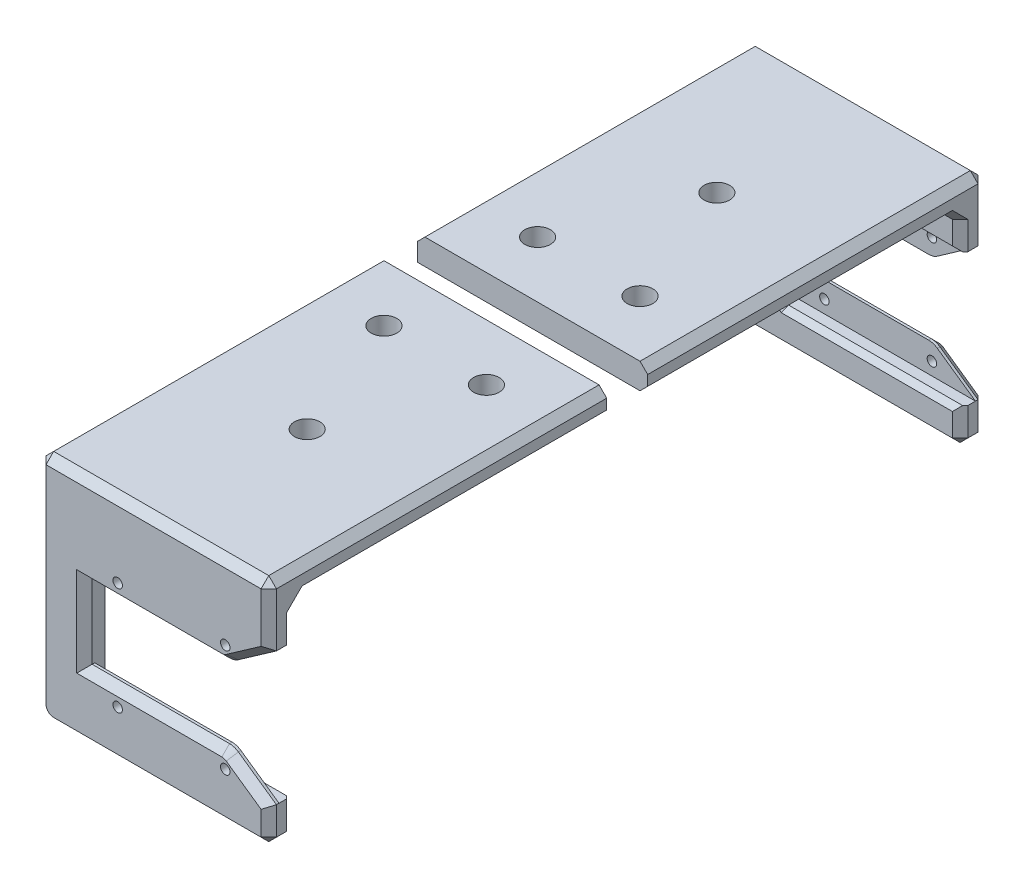
from build123d import *

# Parameters (mm, degrees)
EXTRUDE_1_DEPTH            = 5
SKETCH_2_W                 = 36
SKETCH_2_H                 = 26
CUT_EXTRUDE_1_DEPTH        = 3
CUT_EXTRUDE_2_DEPTH        = 50.497474683
SKETCH_4_R                 = 0.925
CUT_EXTRUDE_3_DEPTH        = 50.335585534
CHAMFER_1_SIZE             = 1.5
CHAMFER_2_SIZE             = 1
FILLET_3_R                 = 3
SKETCH_7_W                 = 45
SKETCH_7_H                 = 140
EXTRUDE_2_DEPTH            = 5
SKETCH_9_R                 = 2.5
CUT_EXTRUDE_5_DEPTH        = 150.248115566
CHAMFER_1_OF_MIRROR_1_SIZE = 1.5
CHAMFER_2_OF_MIRROR_1_SIZE = 1
FILLET_3_OF_MIRROR_1_R     = 3
EXTRUDE_3_DEPTH            = 3
CHAMFER_4_SIZE             = 1.5
SKETCH_12_W                = 45
SKETCH_12_H                = 8
CUT_EXTRUDE_6_DEPTH        = 150.248115566


with BuildPart() as part:
    # 草图1 → 凸台-拉伸1 (new body)
    with BuildSketch(Plane.XY):
        with BuildLine():
            Line((-42, -20), (0, -20))
            ThreePointArc((0, -20), (20, 0), (0, 20))
            Line((0, 20), (-45, 20))
            Line((-45, 20), (-45, -17))
            ThreePointArc((-45, -17), (-44.121320344, -19.121320344), (-42, -20))
        make_face()
    extrude_1 = extrude(amount=EXTRUDE_1_DEPTH)

    # 草图2 → 切除-拉伸1 (cut)
    with BuildSketch(Plane(origin=(0, 0, 0), x_dir=(-1, 0, 0), z_dir=(0, 0, -1))):
        with Locations((18, 0)):
            Rectangle(SKETCH_2_W, SKETCH_2_H)
    cut_extrude_1 = extrude(amount=-CUT_EXTRUDE_1_DEPTH, mode=Mode.SUBTRACT)

    # 草图3 → 切除-拉伸2 (cut, through all)
    with BuildSketch(Plane(origin=(0, 0, 0), x_dir=(-1, 0, 0), z_dir=(0, 0, -1))):
        with BuildLine():
            Line((0, -20), (0, 20))
            ThreePointArc((0, 20), (-20, 0), (0, -20))
        make_face()
    cut_extrude_2 = extrude(amount=-CUT_EXTRUDE_2_DEPTH, mode=Mode.SUBTRACT)

    # 草图4 → 切除-拉伸3 (cut, through all)
    with BuildSketch(Plane(origin=(0, 0, 3), x_dir=(-1, 0, 0), z_dir=(0, 0, -1))):
        with Locations((8.5, 10.5)):
            Circle(SKETCH_4_R)
        with Locations((8.5, -10.5)):
            Circle(SKETCH_4_R)
        with Locations((29.5, 10.5)):
            Circle(SKETCH_4_R)
        with Locations((29.5, -10.5)):
            Circle(SKETCH_4_R)
        Polygon((8.211851039, -7.25), (36, -7.25), (36, 7.25), (8.211851039, 7.25), (0, 13), (0, -13), align=None)
    cut_extrude_3 = extrude(amount=-CUT_EXTRUDE_3_DEPTH, mode=Mode.SUBTRACT)

    # 倒角1
    chamfer_1_edges = [part.edges().sort_by_distance(p)[0] for p in [
        (-36, 13, 1.5),
        (-36, -13, 1.5),
    ]]
    chamfer(chamfer_1_edges, length=CHAMFER_1_SIZE)

    # 倒角2
    chamfer_2_edges = [part.edges().sort_by_distance(p)[0] for p in [
        (-17.25, -13, 0),
        (-17.25, 13, 0),
        (-36, 0, 0),
        (-35.25, 12.25, 0),
        (-35.25, -12.25, 0),
    ]]
    chamfer(chamfer_2_edges, length=CHAMFER_2_SIZE)

    # 圆角3
    fillet_3_edges = [part.edges().sort_by_distance(p)[0] for p in [
        (-8.211851039, 7.25, 4),
        (-8.211851039, -7.25, 4),
    ]]
    fillet(fillet_3_edges, radius=FILLET_3_R)

    # 草图7 → 凸台-拉伸2 (add)
    with BuildSketch(Plane(origin=(0, 20, 0), x_dir=(1, 0, 0), z_dir=(0, 1, 0))):
        with Locations((-22.5, 65)):
            Rectangle(SKETCH_7_W, SKETCH_7_H)
    extrude(amount=EXTRUDE_2_DEPTH)

    # 草图9 → 切除-拉伸5 (cut, through all)
    with BuildSketch(Plane(origin=(0, 25, 0), x_dir=(1, 0, 0), z_dir=(0, 1, 0))):
        with Locations(Location((-12.5, 80, 0), (0, 0, 180))):
            Circle(SKETCH_9_R)
        with Locations(Location((-32.5, 80, 0), (0, 0, 180))):
            Circle(SKETCH_9_R)
        with Locations(Location((-32.5, 50, 0), (0, 0, 180))):
            Circle(SKETCH_9_R)
        with Locations(Location((-12.5, 50, 0), (0, 0, 180))):
            Circle(SKETCH_9_R)
        with Locations(Location((-22.5, 25, 0), (0, 0, 180))):
            Circle(SKETCH_9_R)
        with Locations(Location((-22.5, 105, 0), (0, 0, 180))):
            Circle(SKETCH_9_R)
    extrude(amount=-CUT_EXTRUDE_5_DEPTH, mode=Mode.SUBTRACT)

    # 镜向1: 凸台-拉伸1, 切除-拉伸1, 切除-拉伸2, 切除-拉伸3 across plane
    add(extrude_1.mirror(Plane.XY.offset(-65)))
    add(cut_extrude_1.mirror(Plane.XY.offset(-65)), mode=Mode.SUBTRACT)
    add(cut_extrude_2.mirror(Plane.XY.offset(-65)), mode=Mode.SUBTRACT)
    add(cut_extrude_3.mirror(Plane.XY.offset(-65)), mode=Mode.SUBTRACT)

    # 倒角1 of 镜向1
    chamfer_1_of_mirror_1_edges = [part.edges().sort_by_distance(p)[0] for p in [
        (-36, 13, -131.5),
        (-36, -13, -131.5),
    ]]
    chamfer(chamfer_1_of_mirror_1_edges, length=CHAMFER_1_OF_MIRROR_1_SIZE)

    # 倒角2 of 镜向1
    chamfer_2_of_mirror_1_edges = [part.edges().sort_by_distance(p)[0] for p in [
        (-17.25, -13, -130),
        (-17.25, 13, -130),
        (-36, 0, -130),
        (-35.25, 12.25, -130),
        (-35.25, -12.25, -130),
    ]]
    chamfer(chamfer_2_of_mirror_1_edges, length=CHAMFER_2_OF_MIRROR_1_SIZE)

    # 圆角3 of 镜向1
    fillet_3_of_mirror_1_edges = [part.edges().sort_by_distance(p)[0] for p in [
        (-8.211851039, 7.25, -134),
        (-8.211851039, -7.25, -134),
    ]]
    fillet(fillet_3_of_mirror_1_edges, radius=FILLET_3_OF_MIRROR_1_R)

    # 草图11 → 凸台-拉伸3 (add)
    with BuildSketch(Plane.ZY.offset(45)):
        Polygon((-130, 20), (-130, 1.5), (-111.5, 20), align=None)
        Polygon((0, 20), (-20, 20), (0, 0), align=None)
    extrude(amount=-EXTRUDE_3_DEPTH)

    # 倒角4
    chamfer_4_edges = [part.edges().sort_by_distance(p)[0] for p in [
        (-22.578873703, -7.25, 5),
        (-3.718509048, 10.396271934, 5),
        (-8.255630007, 7.388849148, 5),
        (-8.255630007, -7.388849148, 5),
        (-45, 4, 5),
        (0, 20, -65),
        (-22.5, 25, -135),
        (0, 19, -135),
        (-45, 25, -65),
        (-45, 4, -135),
        (-22.5, 25, 5),
        (0, 25, -65),
        (-44.121320344, -19.121320344, 5),
        (-21, -20, -135),
        (0, -20, -132.5),
        (-44.121320344, -19.121320344, -135),
        (-21, 20, -130),
        (-44.121320344, -19.121320344, -130),
        (-21, -20, -130),
        (0, -17, -130),
        (-21, -20, 5),
        (0, -16.5, -135),
        (-3.718509048, -10.396271934, -135),
        (-36, 0, -135),
        (-22.578873703, 7.25, -135),
        (0, 17, -130),
        (-22.578873703, -7.25, -135),
        (-3.718509048, 10.396271934, -135),
        (-8.255630007, 7.388849148, -135),
        (-8.255630007, -7.388849148, -135),
        (-45, -8.5, 0),
        (-42, 20, -10),
        (-42, 10, 0),
        (-45, -7.75, -130),
        (-42, 10.75, -130),
        (-42, 20, -120.75),
        (0, -16.5, 5),
        (0, -17, 0),
        (0, 19, 5),
        (-21, -20, 0),
        (-22.578873703, 7.25, 5),
        (-36, 0, 5),
        (-3.718509048, -10.396271934, 5),
        (-44.121320344, -19.121320344, 0),
        (-21, 20, 0),
        (0, -20, 2.5),
        (0, 17, 0),
    ]]
    chamfer(chamfer_4_edges, length=CHAMFER_4_SIZE)

    # 草图12 → 切除-拉伸6 (cut, through all)
    with BuildSketch(Plane(origin=(0, 25, 0), x_dir=(1, 0, 0), z_dir=(0, 1, 0))):
        with Locations((-22.5, 65)):
            Rectangle(SKETCH_12_W, SKETCH_12_H)
    extrude(amount=-CUT_EXTRUDE_6_DEPTH, mode=Mode.SUBTRACT)


with BuildPart() as cut_extrude_6_piece_1:
    # of the separate pieces the step leaves, piece 1, a body of its own (cut_extrude_6_pieces)
    add(part.part.solids().sort_by_distance((0, 23.5, -61))[0])


with BuildPart() as cut_extrude_6_piece_2:
    # of the separate pieces the step leaves, piece 2, a body of its own (cut_extrude_6_pieces)
    add(part.part.solids().sort_by_distance((-7.437018096, 7.792543867, -133.5))[0])


solid = Compound([cut_extrude_6_piece_1.part, cut_extrude_6_piece_2.part])
